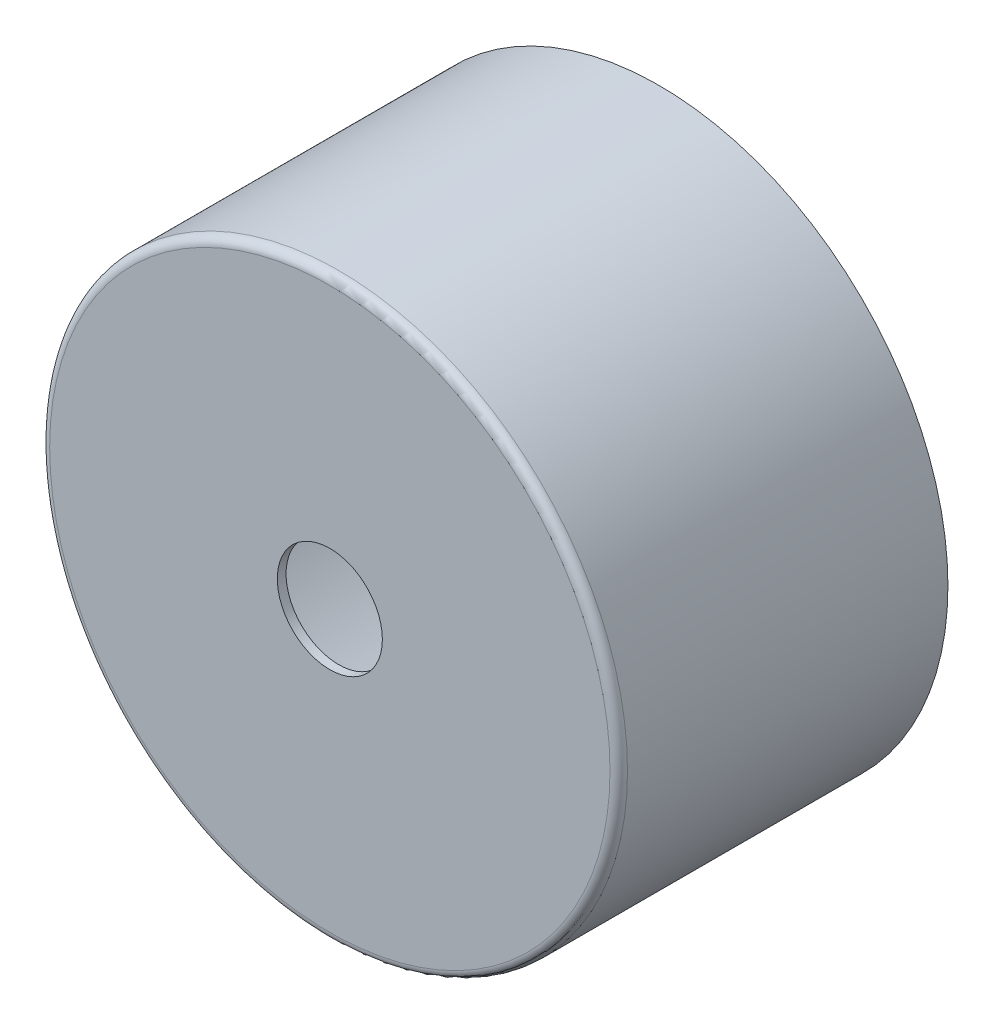
from build123d import *

# Parameters (mm, degrees)
SKETCH1_R           = 16.5
BOSS_EXTRUDE1_DEPTH = 18.8
SHELL1_T            = -0.5
SKETCH2_R           = 3
CUT_EXTRUDE1_DEPTH  = 30.965646998
FILLET1_R           = 0.5


with BuildPart() as part:
    # Sketch1 → Boss-Extrude1 (new body)
    with BuildSketch(Plane.XY):
        Circle(SKETCH1_R)
    extrude(amount=-BOSS_EXTRUDE1_DEPTH)

    # Shell1
    shell1_openings = [part.faces().sort_by_distance(p)[0] for p in [
        (0, 0, -18.8),
    ]]
    offset(amount=SHELL1_T, openings=shell1_openings, kind=Kind.INTERSECTION)

    # Sketch2 → Cut-Extrude1 (cut, through all)
    with BuildSketch(Plane.XY):
        Circle(SKETCH2_R)
    extrude(amount=-CUT_EXTRUDE1_DEPTH, mode=Mode.SUBTRACT)

    # Fillet1
    fillet1_edges = [part.edges().sort_by_distance(p)[0] for p in [
        (-16.5, 0, 0),
    ]]
    fillet(fillet1_edges, radius=FILLET1_R)


solid = part.part
